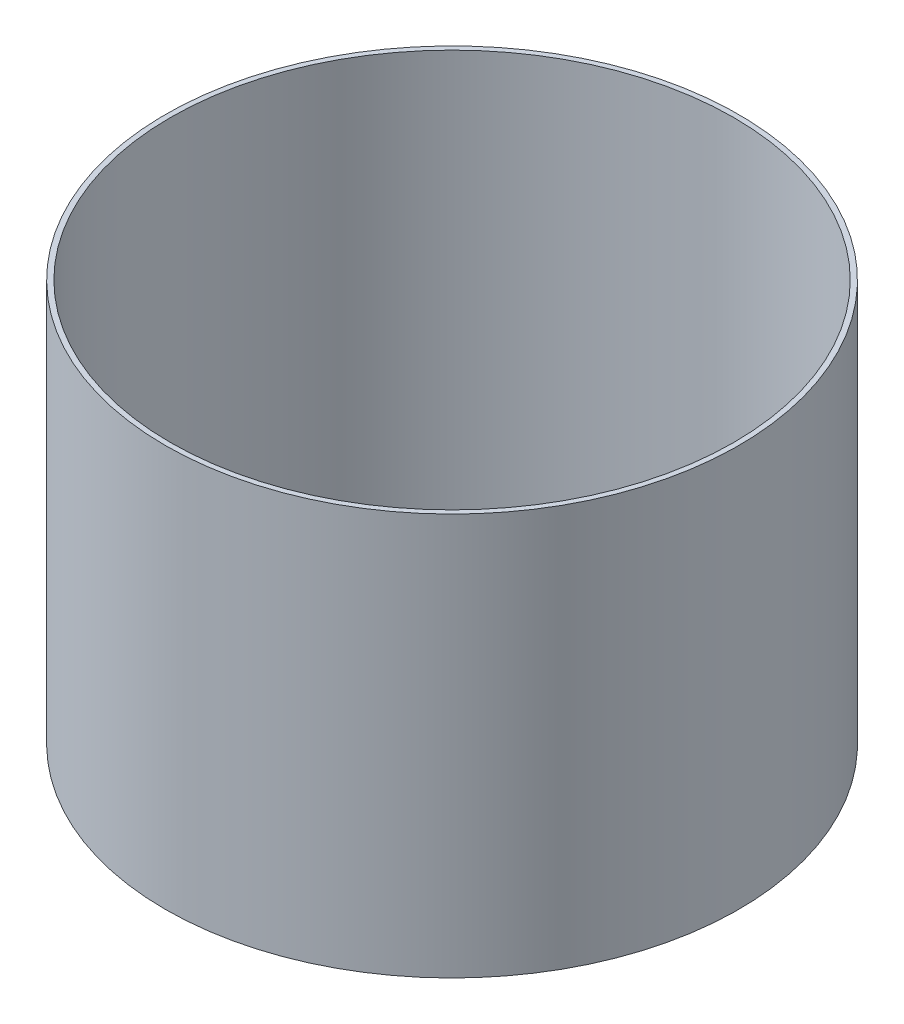
from build123d import *

# Parameters (mm, degrees)
SKETCH2_R      = 71.12
SKETCH2_R_2    = 69.85
EXTRUDE1_DEPTH = 99.6696


with BuildPart() as part:
    # Sketch2 → Extrude1 (new body)
    with BuildSketch(Plane(origin=(0, 0, 0), x_dir=(1, 0, 0), z_dir=(0, 1, 0))):
        with Locations(Location((0, 0, 0), (0, 0, 270))):
            Circle(SKETCH2_R)
        with Locations(Location((0, 0, 0), (0, 0, 270))):
            Circle(SKETCH2_R_2, mode=Mode.SUBTRACT)
    extrude(amount=-EXTRUDE1_DEPTH)


solid = part.part
